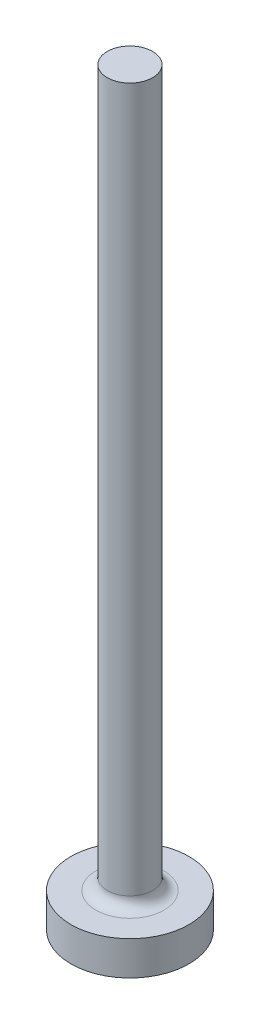
from build123d import *

# Parameters (mm, degrees)
SKETCH1_R           = 2.6
BOSS_EXTRUDE1_DEPTH = 1.5
SKETCH2_R           = 1
BOSS_EXTRUDE2_DEPTH = 31.5
FILLET1_R           = 0.5


with BuildPart() as part:
    # Sketch1 → Boss-Extrude1 (new body)
    with BuildSketch(Plane(origin=(0, 0, 0), x_dir=(1, 0, 0), z_dir=(0, 1, 0))):
        with Locations(Location((0, 0, 0), (0, 0, 270))):
            Circle(SKETCH1_R)
    extrude(amount=BOSS_EXTRUDE1_DEPTH)

    # Sketch2 → Boss-Extrude2 (add)
    with BuildSketch(Plane(origin=(0, 1.5, 0), x_dir=(1, 0, 0), z_dir=(0, 1, 0))):
        with Locations(Location((0, 0, 0), (0, 0, 270))):
            Circle(SKETCH2_R)
    extrude(amount=BOSS_EXTRUDE2_DEPTH)

    # Fillet1
    fillet1_edges = [part.edges().sort_by_distance(p)[0] for p in [
        (0, 1.5, -1),
    ]]
    fillet(fillet1_edges, radius=FILLET1_R)


solid = part.part
